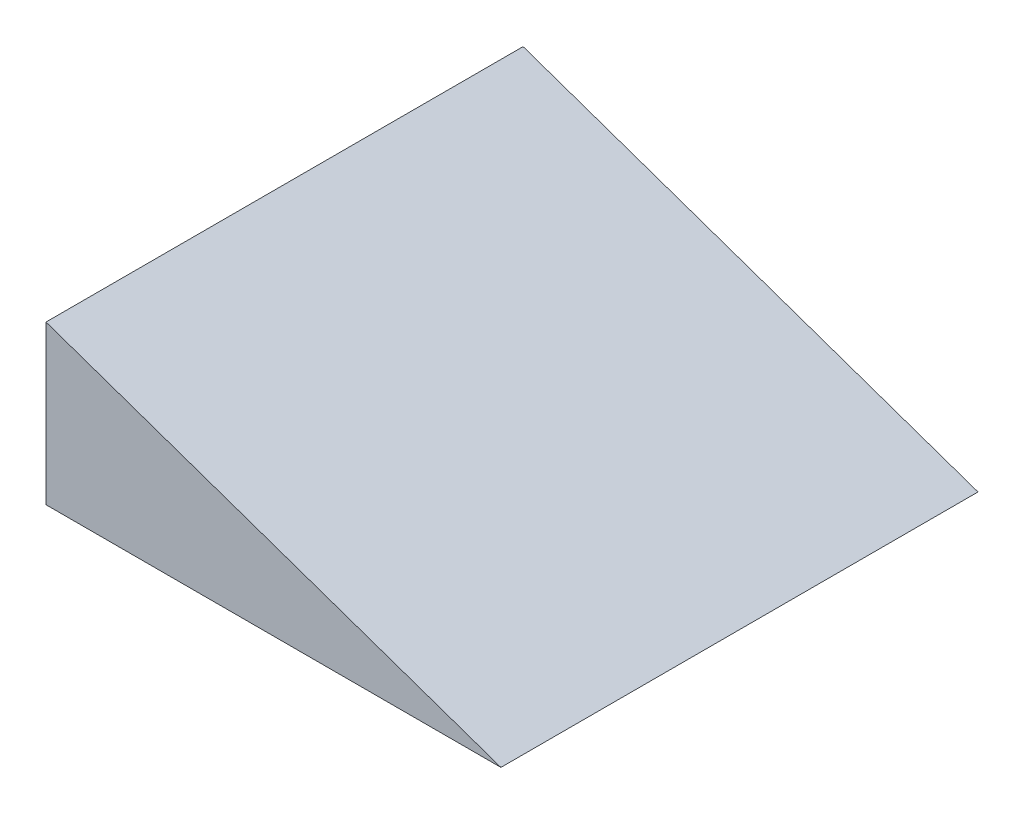
from build123d import *

# Parameters (mm, degrees)
BOSS_EXTRUDE1_DEPTH = 24.12


with BuildPart() as part:
    # Sketch1 → Boss-Extrude1 (new body)
    with BuildSketch(Plane.XY):
        Polygon((0, 0), (23, 0), (0, 8), align=None)
    extrude(amount=BOSS_EXTRUDE1_DEPTH)


solid = part.part
